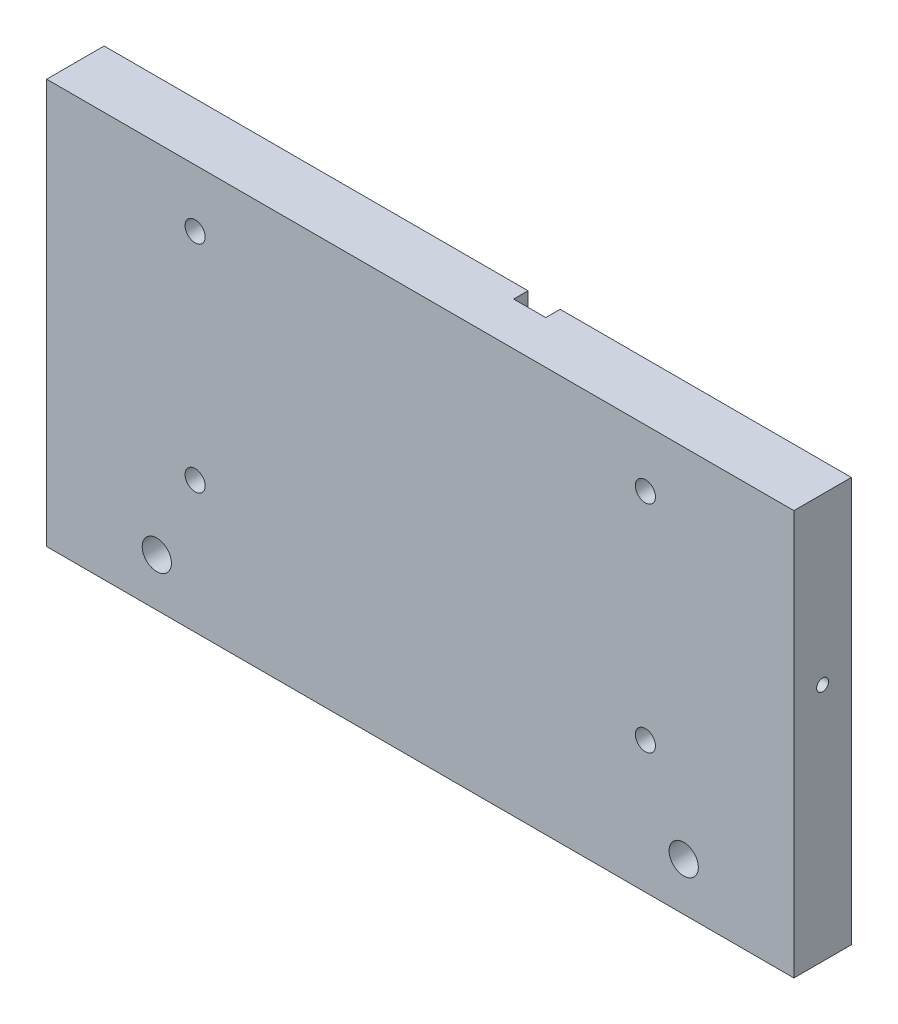
from build123d import *

# Parameters (mm, degrees)
SKETCH1_W                      = 156
SKETCH1_H                      = 84.5
BOSS_EXTRUDE1_DEPTH            = 12
CUT_EXTRUDE1_DEPTH             = 3
F_2_5_2_5_DIAMETER_HOLE1_D     = 2.5
F_2_5_2_5_DIAMETER_HOLE1_DEPTH = 10
F_6_1_6_1_DIAMETER_HOLE1_D     = 6.1
F_4_2_4_2_DIAMETER_HOLE1_D     = 4.2
F_4_2_4_2_DIAMETER_HOLE1_DEPTH = 8


with BuildPart() as part:
    # Sketch1 → Boss-Extrude1 (new body)
    with BuildSketch(Plane.XY.offset(12)):
        with Locations((0, -7.75)):
            Rectangle(SKETCH1_W, SKETCH1_H)
    extrude(amount=-BOSS_EXTRUDE1_DEPTH)

    # Sketch2 → Cut-Extrude1 (cut)
    with BuildSketch(Plane(origin=(0, 0, 0), x_dir=(-1, 0, 0), z_dir=(0, 0, -1))):
        with BuildLine():
            Line((-10.5, 24.003958007), (-10.5, 34.5))
            Line((-10.5, 34.5), (-17.2, 34.5))
            Line((-17.2, 34.5), (-17.2, 20))
            Line((-17.2, 20), (-16.924538398, 20))
            ThreePointArc((-16.924538398, 20), (13.85764217, -22.235236753), (-10.5, 24.003958007))
        make_face()
    extrude(amount=-CUT_EXTRUDE1_DEPTH, mode=Mode.SUBTRACT)

    # Ø2.5 (2.5) Diameter Hole1
    with Locations(Plane(origin=(78, 0, 0), x_dir=(0, 0, -1), z_dir=(1, 0, 0))):
        with Locations((-6, 0)):
            Hole(F_2_5_2_5_DIAMETER_HOLE1_D / 2, depth=F_2_5_2_5_DIAMETER_HOLE1_DEPTH)

    # Ø6.1 (6.1) Diameter Hole1 (through all)
    with Locations(Plane(origin=(0, 0, 0), x_dir=(-1, 0, 0), z_dir=(0, 0, -1))):
        with Locations((-55, -40), (55, -40)):
            Hole(F_6_1_6_1_DIAMETER_HOLE1_D / 2)

    # Ø4.2 (4.2) Diameter Hole1
    with Locations(Plane.XY.offset(12)):
        with Locations((47, 22.5), (-47, 22.5), (47, -22.5), (-47, -22.5)):
            Hole(F_4_2_4_2_DIAMETER_HOLE1_D / 2, depth=F_4_2_4_2_DIAMETER_HOLE1_DEPTH)


solid = part.part
